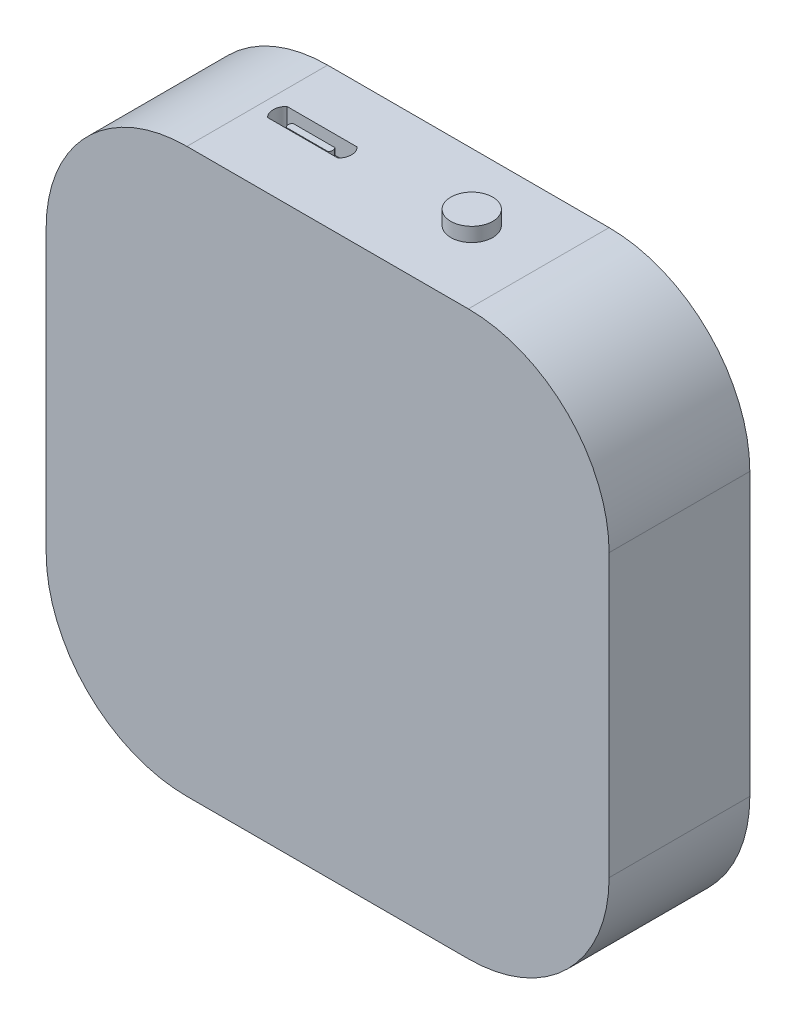
from build123d import *

# Parameters (mm, degrees)
SKETCH1_W           = 40
SKETCH1_H           = 40
BOSS_EXTRUDE2_DEPTH = 10
SKETCH7_R           = 12.5
BOSS_EXTRUDE3_DEPTH = 11
CHAMFER4_SIZE       = 4
SKETCH10_R          = 4
CUT_EXTRUDE2_DEPTH  = 1
SKETCH11_R          = 2.5
CUT_EXTRUDE3_DEPTH  = 2
FILLET2_R           = 10
FILLET3_R           = 10
FILLET4_R           = 10
FILLET5_R           = 10
CUT_EXTRUDE4_DEPTH  = 1.3
BOSS_EXTRUDE5_DEPTH = 1
SKETCH16_R          = 1.490769086
BOSS_EXTRUDE6_DEPTH = 1
SKETCH17_R          = 1.318486688
CUT_EXTRUDE5_DEPTH  = 1


with BuildPart() as part:
    # Sketch1 → Boss-Extrude2 (new body)
    with BuildSketch(Plane.XY):
        with Locations((12.211538462, -8.365384615)):
            Rectangle(SKETCH1_W, SKETCH1_H)
    extrude(amount=-BOSS_EXTRUDE2_DEPTH)

    # Sketch7 → Boss-Extrude3 (add)
    with BuildSketch(Plane(origin=(0, 0, -10), x_dir=(-1, 0, 0), z_dir=(0, 0, -1))):
        with Locations((-12.211538462, -8.365384615)):
            Circle(SKETCH7_R)
    extrude(amount=BOSS_EXTRUDE3_DEPTH)

    # Chamfer4
    chamfer4_edges = [part.edges().sort_by_distance(p)[0] for p in [
        (24.711538462, -8.365384615, -21),
    ]]
    chamfer(chamfer4_edges, length=CHAMFER4_SIZE)

    # Sketch10 → Cut-Extrude2 (cut)
    with BuildSketch(Plane(origin=(0, 0, -21), x_dir=(-1, 0, 0), z_dir=(0, 0, -1))):
        with Locations((-12.126772213, -8.563172529)):
            Circle(SKETCH10_R)
    extrude(amount=-CUT_EXTRUDE2_DEPTH, mode=Mode.SUBTRACT)

    # Sketch11 → Cut-Extrude3 (cut)
    with BuildSketch(Plane.XY):
        with Locations((-3.809282546, 7.542414728)):
            Circle(SKETCH11_R)
    extrude(amount=-CUT_EXTRUDE3_DEPTH, mode=Mode.SUBTRACT)

    # Fillet2
    fillet2_edges = [part.edges().sort_by_distance(p)[0] for p in [
        (32.211538462, 11.634615385, -5),
    ]]
    fillet(fillet2_edges, radius=FILLET2_R)

    # Fillet3
    fillet3_edges = [part.edges().sort_by_distance(p)[0] for p in [
        (-7.788461538, 11.634615385, -5),
    ]]
    fillet(fillet3_edges, radius=FILLET3_R)

    # Fillet4
    fillet4_edges = [part.edges().sort_by_distance(p)[0] for p in [
        (-7.788461538, -28.365384615, -5),
    ]]
    fillet(fillet4_edges, radius=FILLET4_R)

    # Fillet5
    fillet5_edges = [part.edges().sort_by_distance(p)[0] for p in [
        (32.211538462, -28.365384615, -5),
    ]]
    fillet(fillet5_edges, radius=FILLET5_R)

    # Sketch13 → Cut-Extrude4 (cut)
    with BuildSketch(Plane(origin=(0, 11.634615385, 0), x_dir=(1, 0, 0), z_dir=(0, 1, 0))):
        with BuildLine():
            Line((3.30309253, 4.642088904), (8.298895956, 4.642088904))
            ThreePointArc((8.298895956, 4.642088904), (8.582742042, 5.327353975), (8.298895956, 6.012619047))
            Line((8.298895956, 6.012619047), (3.30309253, 6.012619047))
            ThreePointArc((3.30309253, 6.012619047), (3.019246443, 5.327353975), (3.30309253, 4.642088904))
        make_face()
    extrude(amount=-CUT_EXTRUDE4_DEPTH, mode=Mode.SUBTRACT)

    # Sketch14 → Boss-Extrude5 (add)
    with BuildSketch(Plane(origin=(0, 10.334615385, 0), x_dir=(1, 0, 0), z_dir=(0, 1, 0))):
        with BuildLine():
            Line((4.275726825, 5.482091249), (7.237840361, 5.482091249))
            ThreePointArc((7.237840361, 5.482091249), (7.33855994, 5.238932676), (7.237840361, 4.995774102))
            Line((7.237840361, 4.995774102), (4.275726825, 4.995774102))
            ThreePointArc((4.275726825, 4.995774102), (4.175007246, 5.238932676), (4.275726825, 5.482091249))
        make_face()
    extrude(amount=BOSS_EXTRUDE5_DEPTH)

    # Sketch16 → Boss-Extrude6 (add)
    with BuildSketch(Plane(origin=(0, 11.634615385, 0), x_dir=(1, 0, 0), z_dir=(0, 1, 0))):
        with Locations(Location((17.198709177, 5.253755482, 0), (0, 0, 270))):
            Circle(SKETCH16_R)
    extrude(amount=BOSS_EXTRUDE6_DEPTH)

    # Sketch17 → Cut-Extrude5 (cut)
    with BuildSketch(Plane(origin=(0, 0, -20), x_dir=(-1, 0, 0), z_dir=(0, 0, -1))):
        with Locations((-12.126772213, -8.563172529)):
            Circle(SKETCH17_R)
    extrude(amount=-CUT_EXTRUDE5_DEPTH, mode=Mode.SUBTRACT)


solid = part.part
